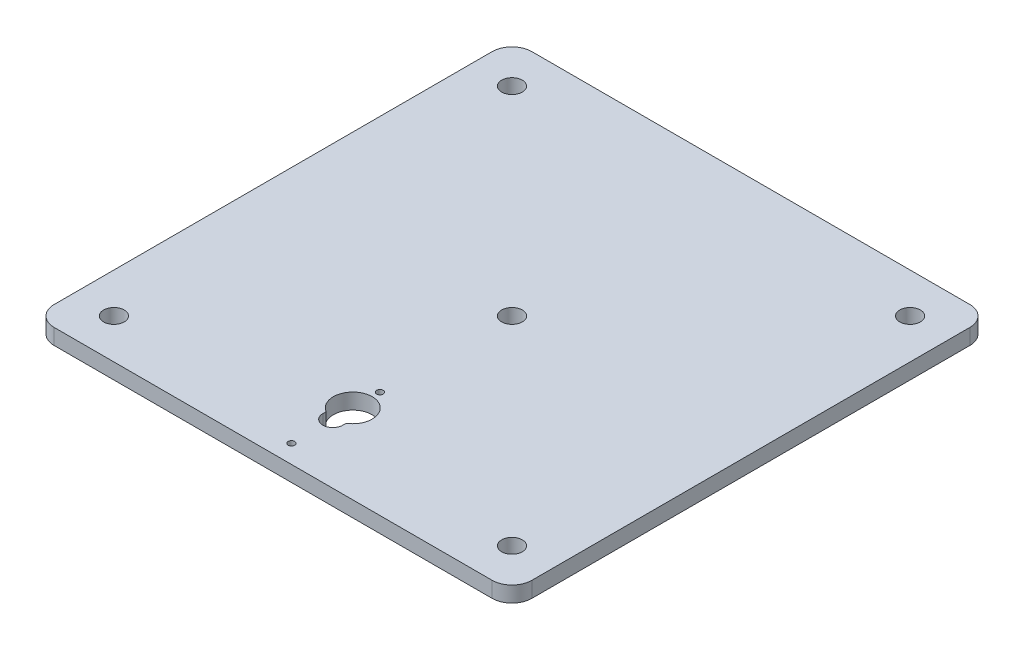
from build123d import *

# Parameters (mm, degrees)
SKETCH1_R           = 3.302
BOSS_EXTRUDE1_DEPTH = 5
SKETCH2_R           = 1.05
CUT_EXTRUDE2_DEPTH  = 108.879006299


with BuildPart() as part:
    # Sketch1 → Boss-Extrude1 (new body)
    with BuildSketch(Plane(origin=(0, 0, 0), x_dir=(1, 0, 0), z_dir=(0, 1, 0))):
        with BuildLine():
            Line((-69.85, 76.2), (69.85, 76.2))
            ThreePointArc((69.85, 76.2), (74.340128061, 74.340128061), (76.2, 69.85))
            Line((76.2, 69.85), (76.2, -69.85))
            ThreePointArc((76.2, -69.85), (74.340128061, -74.340128061), (69.85, -76.2))
            Line((69.85, -76.2), (-69.85, -76.2))
            ThreePointArc((-69.85, -76.2), (-74.340128061, -74.340128061), (-76.2, -69.85))
            Line((-76.2, -69.85), (-76.2, 69.85))
            ThreePointArc((-76.2, 69.85), (-74.340128061, 74.340128061), (-69.85, 76.2))
        make_face()
        with Locations(Location((63.5, 63.5, 0), (0, 0, 270))):
            Circle(SKETCH1_R, mode=Mode.SUBTRACT)
        with Locations(Location((63.5, -63.5, 0), (0, 0, 90))):
            Circle(SKETCH1_R, mode=Mode.SUBTRACT)
        with Locations(Location((-63.5, -63.5, 0), (0, 0, 270))):
            Circle(SKETCH1_R, mode=Mode.SUBTRACT)
        with Locations(Location((-63.5, 63.5, 0), (0, 0, 90))):
            Circle(SKETCH1_R, mode=Mode.SUBTRACT)
        with Locations(Location((0, 0, 0), (0, 0, 270))):
            Circle(SKETCH1_R, mode=Mode.SUBTRACT)
    extrude(amount=BOSS_EXTRUDE1_DEPTH)

    # Sketch2 → Cut-Extrude2 (cut, through all)
    with BuildSketch(Plane(origin=(0, 0, 0), x_dir=(1, 0, 0), z_dir=(0, 1, 0))):
        with Locations(Location((0, -42.125, 0), (0, 0, 270))):
            Circle(SKETCH2_R)
        with Locations(Location((0, -70.375, 0), (0, 0, 270))):
            Circle(SKETCH2_R)
        with BuildLine():
            Line((-3.2, -56.110367219), (-3.2, -57.15))
            ThreePointArc((-3.2, -57.15), (0, -60.35), (3.2, -57.15))
            Line((3.2, -57.15), (3.2, -56.110367219))
            ThreePointArc((3.2, -56.110367219), (0, -44.6), (-3.2, -56.110367219))
        make_face()
    extrude(amount=CUT_EXTRUDE2_DEPTH, mode=Mode.SUBTRACT)


solid = part.part
